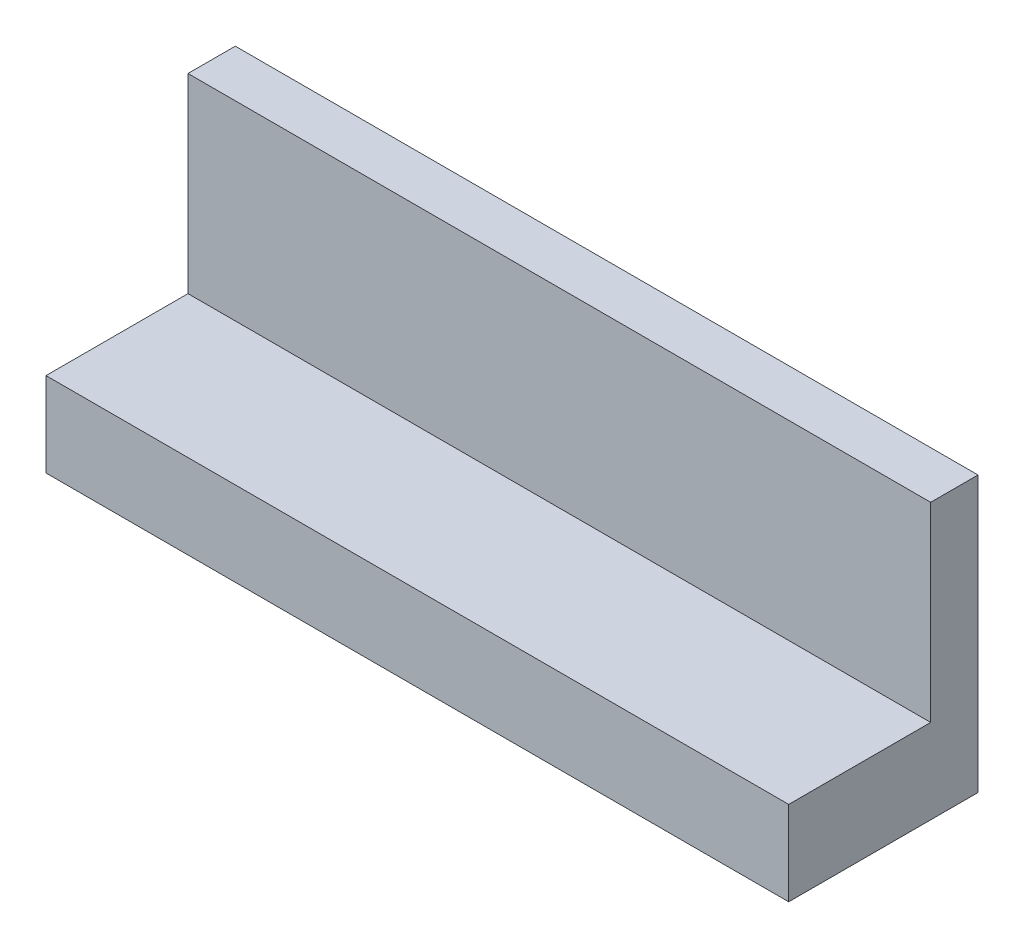
from build123d import *

# Parameters (mm, degrees)
SKETCH_1_W      = 156.946964028
SKETCH_1_H      = 58.118585656
EXTRUDE_1_DEPTH = 5
SKETCH_2_W      = 156.946964028
SKETCH_2_H      = 17.832381092
EXTRUDE_2_DEPTH = 30


with BuildPart() as part:
    # 草图1 → 凸台-拉伸1 (new, symmetric)
    with BuildSketch(Plane.XY):
        Rectangle(SKETCH_1_W, SKETCH_1_H)
    extrude(amount=EXTRUDE_1_DEPTH, both=True)

    # 草图2 → 凸台-拉伸2 (add)
    with BuildSketch(Plane.XY.offset(5)):
        with Locations((0, -20.143102282)):
            Rectangle(SKETCH_2_W, SKETCH_2_H)
    extrude(amount=EXTRUDE_2_DEPTH)


solid = part.part
